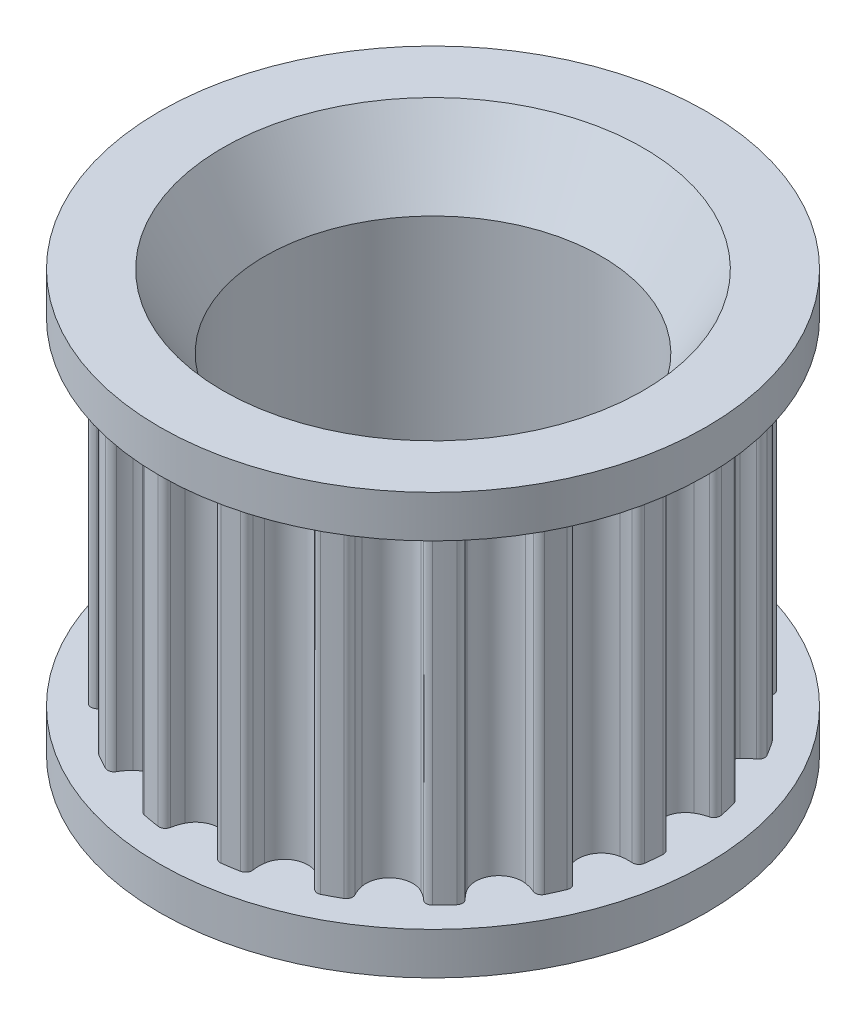
from build123d import *
from OCP.BRepFilletAPI import BRepFilletAPI_MakeChamfer

# Parameters (mm, degrees)
SKETCH1_R           = 6.5
SKETCH1_R_2         = 4
BOSS_EXTRUDE1_DEPTH = 10
CUT_EXTRUDE1_DEPTH  = 8
CIRPATTERN1_COUNT   = 19
CHAMFER1_SIZE       = 1
CHAMFER1_SIZE2      = 1.732050808


with BuildPart() as part:
    # Sketch1 → Boss-Extrude1 (new body)
    with BuildSketch(Plane(origin=(0, 0, 0), x_dir=(1, 0, 0), z_dir=(0, 1, 0))):
        Circle(SKETCH1_R)
        Circle(SKETCH1_R_2, mode=Mode.SUBTRACT)
    extrude(amount=BOSS_EXTRUDE1_DEPTH)

    # Sketch2 → Cut-Extrude1 (cut)
    with BuildSketch(Plane(origin=(0, 1, 0), x_dir=(1, 0, 0), z_dir=(0, 1, 0))):
        with BuildLine():
            Line((0, 6.5), (0, 5.795))
            ThreePointArc((0, 5.795), (0.122937045, 5.79369584), (0.245818756, 5.789783946))
            ThreePointArc((0.245818756, 5.789783946), (0.347788537, 5.743668839), (0.389455844, 5.639802218))
            ThreePointArc((0.389455844, 5.639802218), (0.399058364, 5.500772603), (0.427895826, 5.364428028))
            ThreePointArc((0.427895826, 5.364428028), (0.866263858, 4.970071622), (1.412199156, 5.192867844))
            ThreePointArc((1.412199156, 5.192867844), (1.485463498, 5.311416478), (1.54153551, 5.438999282))
            ThreePointArc((1.54153551, 5.438999282), (1.6158854, 5.522644563), (1.727443748, 5.53154256))
            ThreePointArc((1.727443748, 5.53154256), (1.84440296, 5.493651128), (1.960532009, 5.453287013))
            Line((1.960532009, 5.453287013), (2.199043668, 6.116715372))
            ThreePointArc((2.199043668, 6.116715372), (1.116098132, 6.403461951), (0, 6.5))
        make_face()
    cut_extrude1 = extrude(amount=CUT_EXTRUDE1_DEPTH, mode=Mode.SUBTRACT)

    # CirPattern1: Cut-Extrude1 ×19 about axis
    cirpattern1_axis = Axis((0, 10, 0), (0, -1, 0))
    for i in range(1, CIRPATTERN1_COUNT):
        add(cut_extrude1.rotate(cirpattern1_axis, i * 360 / CIRPATTERN1_COUNT), mode=Mode.SUBTRACT)

    # Chamfer1: one chamfer whose edges measure the first distance from different faces: ONE call of the kernel's chamfer builder (chamfer() names one face for all edges)
    chamfer1_edges_1 = [part.edges().sort_by_distance(p)[0] for p in [
        (-4, 10, 0),
    ]]
    chamfer1_side_1 = [part.faces().sort_by_distance(p)[0] for p in [
        (-6.316152237, 10, 0),
    ]]
    chamfer1_edges_2 = [part.edges().sort_by_distance(p)[0] for p in [
        (-4, 0, 0),
    ]]
    chamfer1_side_2 = [part.faces().sort_by_distance(p)[0] for p in [
        (-4, 5, 0),
    ]]
    chamfer1 = BRepFilletAPI_MakeChamfer(part.part.solid().wrapped)
    for e in chamfer1_edges_1:
        chamfer1.Add(CHAMFER1_SIZE, CHAMFER1_SIZE2, e.wrapped, chamfer1_side_1[0].wrapped)  # the first distance lies on this face
    for e in chamfer1_edges_2:
        chamfer1.Add(CHAMFER1_SIZE, CHAMFER1_SIZE2, e.wrapped, chamfer1_side_2[0].wrapped)  # the first distance lies on this face
    add(Compound.cast(chamfer1.Shape()), mode=Mode.REPLACE)


solid = part.part
